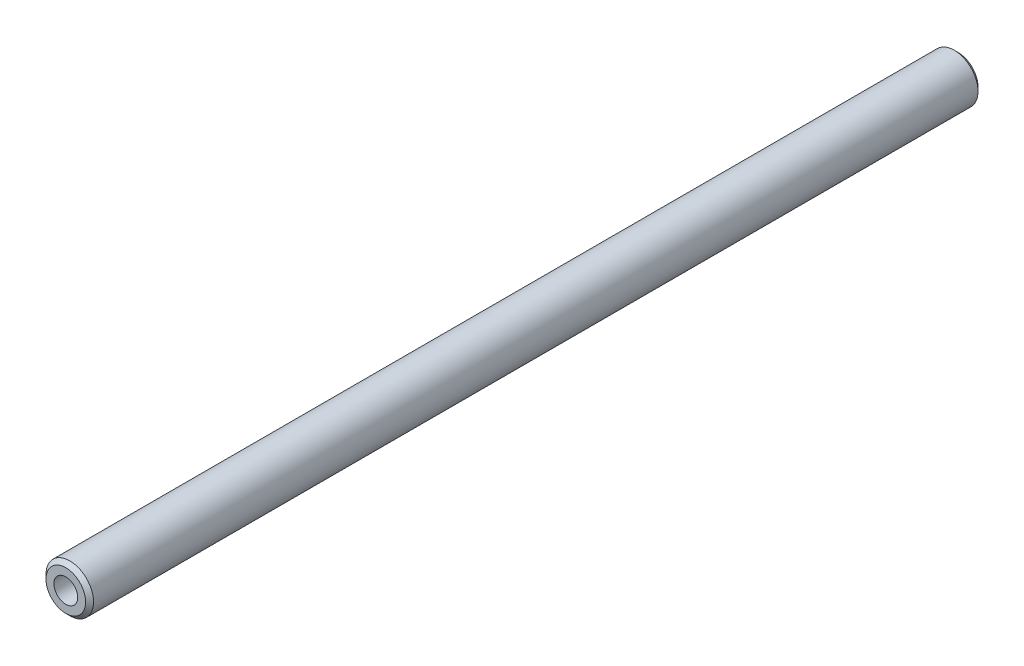
from build123d import *

# Parameters (mm, degrees)
SKETCH_1_R      = 6
SKETCH_1_R_2    = 3
EXTRUDE_1_DEPTH = 225
CHAMFER_1_SIZE  = 1


with BuildPart() as part:
    # 草图1 → 凸台-拉伸1 (new body)
    with BuildSketch(Plane.XY):
        Circle(SKETCH_1_R)
        Circle(SKETCH_1_R_2, mode=Mode.SUBTRACT)
    extrude(amount=EXTRUDE_1_DEPTH)

    # 倒角1
    chamfer_1_edges = [part.edges().sort_by_distance(p)[0] for p in [
        (-6, 0, 0),
        (-6, 0, 225),
    ]]
    chamfer(chamfer_1_edges, length=CHAMFER_1_SIZE)


solid = part.part
